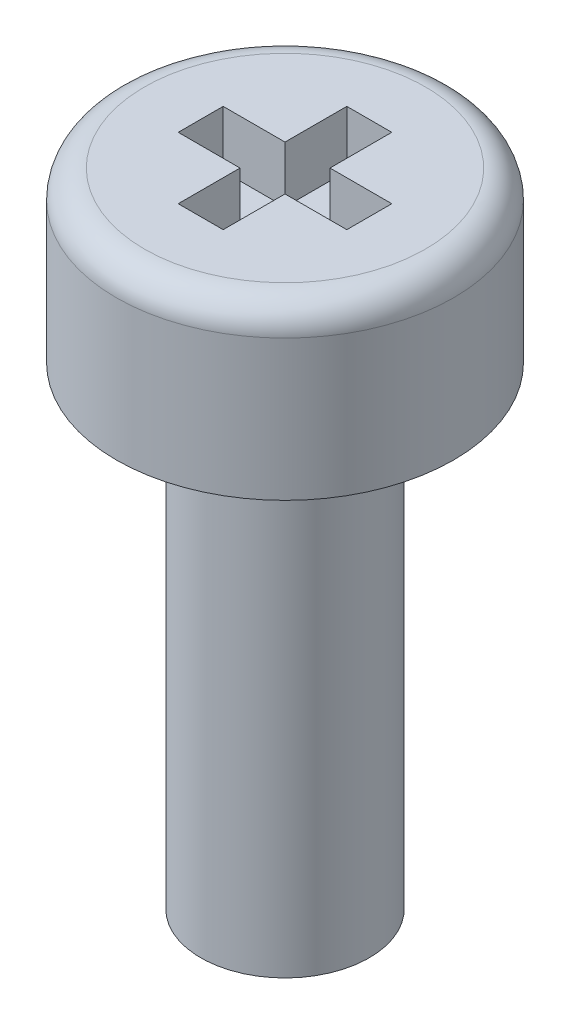
from build123d import *

# Parameters (mm, degrees)
SKETCH1_R           = 3
BOSS_EXTRUDE1_DEPTH = 3
SKETCH2_R           = 1.5
BOSS_EXTRUDE2_DEPTH = 8.42
FILLET1_R           = 0.5
SKETCH3_W           = 0.8
SKETCH3_H           = 1.1
SKETCH3_W_2         = 1.1
SKETCH3_H_2         = 0.8
CUT_EXTRUDE1_DEPTH  = 1


with BuildPart() as part:
    # Sketch1 → Boss-Extrude1 (new body)
    with BuildSketch(Plane(origin=(0, 0, 0), x_dir=(1, 0, 0), z_dir=(0, 1, 0))):
        with Locations(Location((0, 0, 0), (0, 0, 270))):
            Circle(SKETCH1_R)
    extrude(amount=BOSS_EXTRUDE1_DEPTH)

    # Sketch2 → Boss-Extrude2 (add)
    with BuildSketch(Plane.XZ):
        with Locations(Location((0, 0, 0), (0, 0, 270))):
            Circle(SKETCH2_R)
    extrude(amount=BOSS_EXTRUDE2_DEPTH)

    # Fillet1
    fillet1_edges = [part.edges().sort_by_distance(p)[0] for p in [
        (0, 3, -3),
    ]]
    fillet(fillet1_edges, radius=FILLET1_R)

    # Sketch3 → Cut-Extrude1 (cut)
    with BuildSketch(Plane(origin=(0, 3, 0), x_dir=(1, 0, 0), z_dir=(0, 1, 0))):
        with Locations((0, 0.95)):
            Rectangle(SKETCH3_W, SKETCH3_H)
        with Locations((0.95, 0)):
            Rectangle(SKETCH3_W_2, SKETCH3_H_2)
        with Locations((0, -0.95)):
            Rectangle(SKETCH3_W, SKETCH3_H)
        with Locations((-0.95, 0)):
            Rectangle(SKETCH3_W_2, SKETCH3_H_2)
        Rectangle(SKETCH3_W, SKETCH3_H_2)
    extrude(amount=-CUT_EXTRUDE1_DEPTH, mode=Mode.SUBTRACT)


solid = part.part
